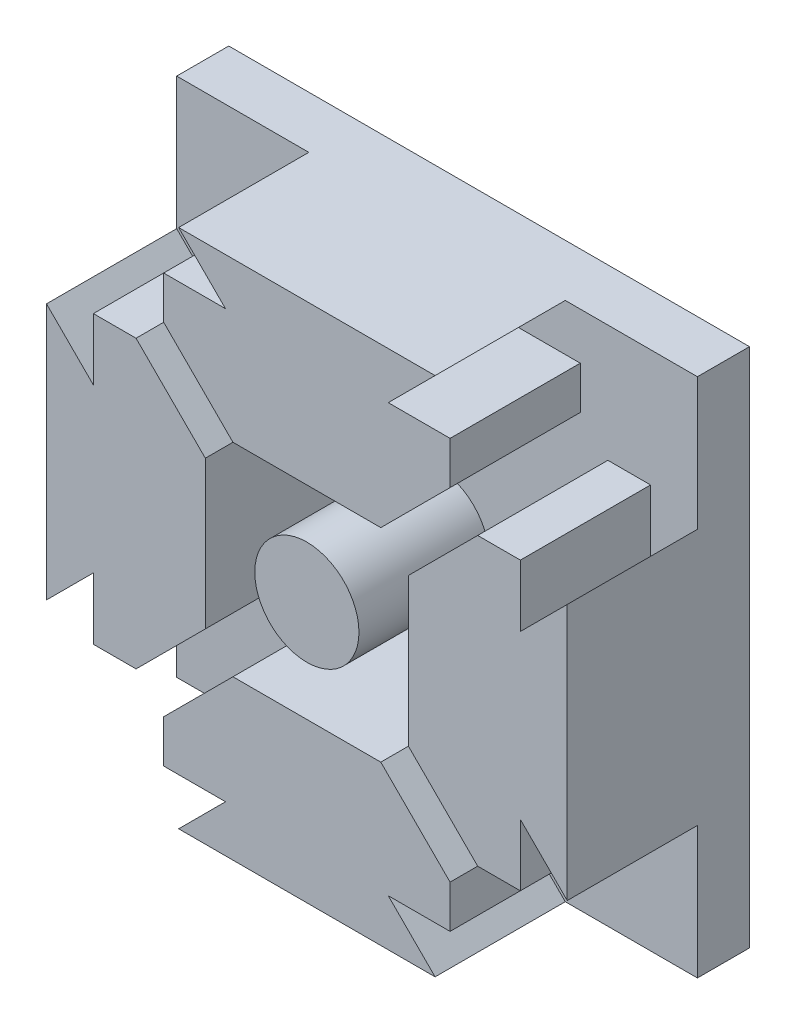
from build123d import *

# Parameters (mm, degrees)
BOSS_EXTRUDE1_DEPTH   = 5
BOSS_EXTRUDE1_2_DEPTH = 5
BOSS_EXTRUDE1_3_DEPTH = 5
BOSS_EXTRUDE1_4_DEPTH = 5
SKETCH1_R             = 2
BOSS_EXTRUDE1_5_DEPTH = 5
SKETCH1_3_W           = 20
SKETCH1_3_H           = 20
BOSS_EXTRUDE2_DEPTH   = 2


with BuildPart() as part:
    # Sketch1 → Boss-Extrude1 (new body)
    with BuildSketch(Plane.XY):
        Polygon((4.925, 10), (-4.925, 10), (-3.125, 8.2), (-5.5, 8.2), (-5.5, 6.560660172), (-2.839339828, 3.9), (2.839339828, 3.9), (5.5, 6.560660172), (5.5, 8.2), (3.125, 8.2), align=None)
    extrude(amount=BOSS_EXTRUDE1_DEPTH)



with BuildPart() as body_2:
    # Sketch1 → Boss-Extrude1 2 (new body)
    with BuildSketch(Plane.XY):
        Polygon((-8.2, 3.125), (-10, 4.925), (-10, -4.925), (-8.2, -3.125), (-8.2, -5.5), (-6.560660172, -5.5), (-3.9, -2.839339828), (-3.9, 2.839339828), (-6.560660172, 5.5), (-8.2, 5.5), align=None)
    extrude(amount=BOSS_EXTRUDE1_2_DEPTH)


with BuildPart() as body_3:
    # Sketch1 → Boss-Extrude1 3 (new body)
    with BuildSketch(Plane.XY):
        Polygon((10, -4.925), (10, 4.925), (8.2, 3.125), (8.2, 5.5), (6.560660172, 5.5), (3.9, 2.839339828), (3.9, -2.839339828), (6.560660172, -5.5), (8.2, -5.5), (8.2, -3.125), align=None)
    extrude(amount=BOSS_EXTRUDE1_3_DEPTH)


with BuildPart() as body_4:
    # Sketch1 → Boss-Extrude1 4 (new body)
    with BuildSketch(Plane.XY):
        Polygon((-3.125, -8.2), (-4.925, -10), (4.925, -10), (3.125, -8.2), (5.5, -8.2), (5.5, -6.560660172), (2.839339828, -3.9), (-2.839339828, -3.9), (-5.5, -6.560660172), (-5.5, -8.2), align=None)
    extrude(amount=BOSS_EXTRUDE1_4_DEPTH)


with BuildPart() as body_5:
    # Sketch1 → Boss-Extrude1 5 (new body)
    with BuildSketch(Plane.XY):
        Circle(SKETCH1_R)
    extrude(amount=BOSS_EXTRUDE1_5_DEPTH)


with BuildPart() as part_1:
    add(part.part)

    add(body_2.part)  # Boss-Extrude2 merges body 2

    add(body_3.part)  # Boss-Extrude2 merges body 3

    add(body_4.part)  # Boss-Extrude2 merges body 4

    add(body_5.part)  # Boss-Extrude2 merges body 5
    # Sketch1<3> → Boss-Extrude2 (add)
    with BuildSketch(Plane.XY):
        Rectangle(SKETCH1_3_W, SKETCH1_3_H)
    extrude(amount=-BOSS_EXTRUDE2_DEPTH)


solid = part_1.part
